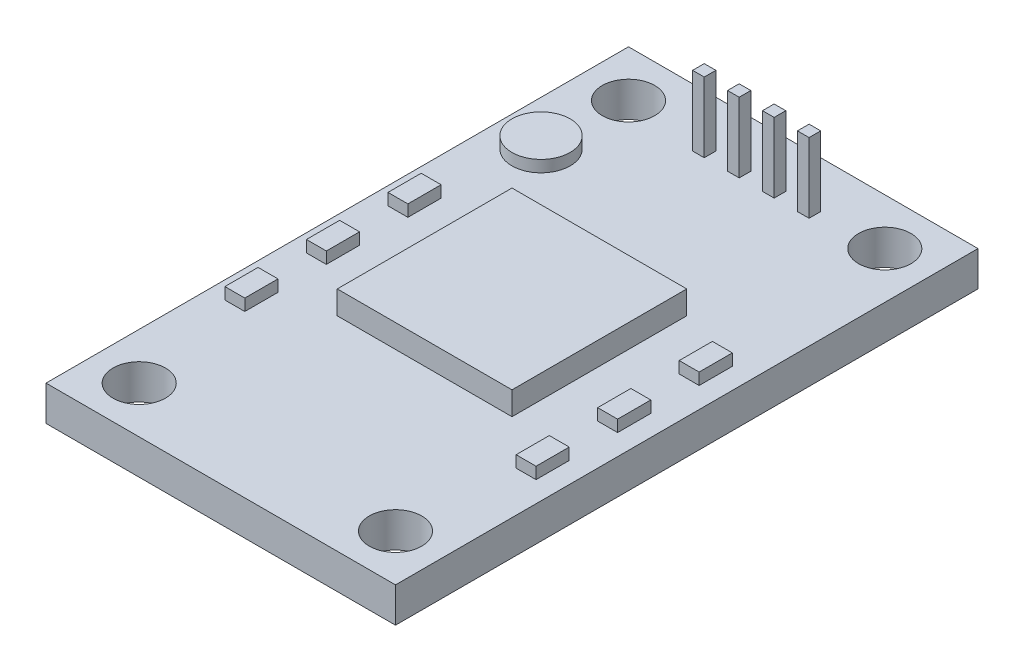
from build123d import *

# Parameters (mm, degrees)
SKETCH1_W            = 30
SKETCH1_H            = 50
BOSS_EXTRUDE1_DEPTH  = 3
SKETCH2_R            = 2.25
CUT_EXTRUDE1_DEPTH   = 3
LPATTERN1_COUNT      = 2
LPATTERN1_PITCH      = 22
LPATTERN1_COUNT_DIR2 = 2
LPATTERN1_PITCH_DIR2 = 42
SKETCH3_W            = 1
SKETCH3_H            = 1
BOSS_EXTRUDE2_DEPTH  = 6
LPATTERN2_COUNT      = 4
LPATTERN2_PITCH      = 3
SKETCH4_W            = 15
SKETCH4_H            = 15
BOSS_EXTRUDE3_DEPTH  = 2
SKETCH5_W            = 1.709574014
SKETCH5_H            = 2.849290021
BOSS_EXTRUDE4_DEPTH  = 1
LPATTERN3_COUNT      = 3
LPATTERN3_PITCH      = 7
LPATTERN3_COUNT_DIR2 = 2
LPATTERN3_PITCH_DIR2 = 25
SKETCH6_R            = 2.5
BOSS_EXTRUDE5_DEPTH  = 1


with BuildPart() as part:
    # Sketch1 → Boss-Extrude1 (new body)
    with BuildSketch(Plane(origin=(0, 0, 0), x_dir=(1, 0, 0), z_dir=(0, 1, 0))):
        Rectangle(SKETCH1_W, SKETCH1_H)
    extrude(amount=BOSS_EXTRUDE1_DEPTH)

    # Sketch2 → Cut-Extrude1 (cut)
    with BuildSketch(Plane(origin=(0, 3, 0), x_dir=(1, 0, 0), z_dir=(0, 1, 0))):
        with Locations(Location((-11, 21, 0), (0, 0, 270))):
            Circle(SKETCH2_R)
    cut_extrude1 = extrude(amount=-CUT_EXTRUDE1_DEPTH, mode=Mode.SUBTRACT)

    # LPattern1: Cut-Extrude1 2 × 2
    with Locations(*[(i * LPATTERN1_PITCH, 0, j * LPATTERN1_PITCH_DIR2) for i in range(LPATTERN1_COUNT) for j in range(LPATTERN1_COUNT_DIR2) if (i, j) != (0, 0)]):
        add(cut_extrude1, mode=Mode.SUBTRACT)

    # Sketch3 → Boss-Extrude2 (add)
    with BuildSketch(Plane(origin=(0, 3, 0), x_dir=(1, 0, 0), z_dir=(0, 1, 0))):
        with Locations((-4, 20.5)):
            Rectangle(SKETCH3_W, SKETCH3_H)
    boss_extrude2 = extrude(amount=BOSS_EXTRUDE2_DEPTH)

    # LPattern2: Boss-Extrude2 ×4
    with Locations(*[(i * LPATTERN2_PITCH, 0, 0) for i in range(1, LPATTERN2_COUNT)]):
        add(boss_extrude2)

    # Sketch4 → Boss-Extrude3 (add)
    with BuildSketch(Plane(origin=(0, 3, 0), x_dir=(1, 0, 0), z_dir=(0, 1, 0))):
        Rectangle(SKETCH4_W, SKETCH4_H)
    extrude(amount=BOSS_EXTRUDE3_DEPTH)

    # Sketch5 → Boss-Extrude4 (add)
    with BuildSketch(Plane(origin=(0, 3, 0), x_dir=(1, 0, 0), z_dir=(0, 1, 0))):
        with Locations((-12.643724472, -9.7232022)):
            Rectangle(SKETCH5_W, SKETCH5_H)
    boss_extrude4 = extrude(amount=BOSS_EXTRUDE4_DEPTH)

    # LPattern3: Boss-Extrude4 3 × 2
    with Locations(*[(j * LPATTERN3_PITCH_DIR2, 0, -i * LPATTERN3_PITCH) for i in range(LPATTERN3_COUNT) for j in range(LPATTERN3_COUNT_DIR2) if (i, j) != (0, 0)]):
        add(boss_extrude4)

    # Sketch6 → Boss-Extrude5 (add)
    with BuildSketch(Plane(origin=(0, 3, 0), x_dir=(1, 0, 0), z_dir=(0, 1, 0))):
        with Locations(Location((-11.14784721, 13.64097598, 0), (0, 0, 90))):
            Circle(SKETCH6_R)
    extrude(amount=BOSS_EXTRUDE5_DEPTH)


solid = part.part
